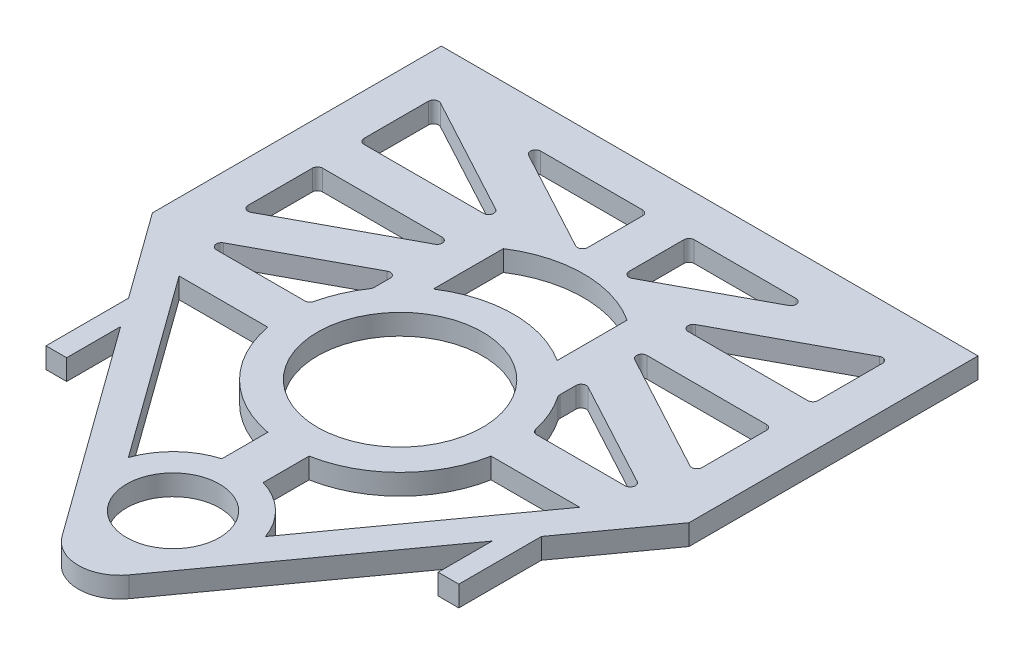
from build123d import *

# Parameters (mm, degrees)
BOSS_EXTRUDE1_DEPTH = 6.35
BOSS_EXTRUDE2_DEPTH = 6.35
CUT_EXTRUDE2_REACH  = 173.121
SKETCH3_R           = 25.4
SKETCH3_R_2         = 14.2875


with BuildPart() as part:
    # Sketch1 → Boss-Extrude1 (new body)
    with BuildSketch(Plane(origin=(0, 0, 0), x_dir=(1, 0, 0), z_dir=(0, 1, 0))):
        with BuildLine():
            Line((-82.55, -44.45), (-10.295626201, -144.494517568))
            ThreePointArc((-10.295626201, -144.494517568), (0, -149.758787534), (10.295626201, -144.494517568))
            Line((10.295626201, -144.494517568), (82.55, -44.45))
            Line((82.55, -44.45), (82.55, 44.45))
            Line((82.55, 44.45), (-82.55, 44.45))
            Line((-82.55, 44.45), (-82.55, -44.45))
        make_face()
    extrude(amount=BOSS_EXTRUDE1_DEPTH)

    # Sketch4 → Boss-Extrude2 (add)
    with BuildSketch(Plane(origin=(0, 6.35, 0), x_dir=(1, 0, 0), z_dir=(0, 1, 0))):
        Polygon((-63.5, -70.826923077), (-63.5, -96.226923077), (-57.15, -96.226923077), (-57.15, -79.619230769), align=None)
        Polygon((57.15, -96.226923077), (63.5, -96.226923077), (63.5, -70.826923077), (57.15, -79.619230769), align=None)
    extrude(amount=-BOSS_EXTRUDE2_DEPTH)

    # Sketch3 → Cut-Extrude2 (cut, up to next)
    with BuildSketch(Plane(origin=(0, 6.35, 0), x_dir=(1, 0, 0), z_dir=(0, 1, 0)), mode=Mode.PRIVATE) as cut_extrude2_sk1:
        with Locations(Location((0, -50.8, 0), (0, 0, 270))):
            Circle(SKETCH3_R)
    cut_extrude2_tool1 = extrude(cut_extrude2_sk1.sketch, amount=-CUT_EXTRUDE2_REACH, mode=Mode.PRIVATE) & part.part
    # Sketch3 → Cut-Extrude2 (cut, up to next)
    with BuildSketch(Plane(origin=(0, 6.35, 0), x_dir=(1, 0, 0), z_dir=(0, 1, 0)), mode=Mode.PRIVATE) as cut_extrude2_sk2:
        with Locations(Location((0, -120.65, 0), (0, 0, 270))):
            Circle(SKETCH3_R_2)
    cut_extrude2_tool2 = extrude(cut_extrude2_sk2.sketch, amount=-CUT_EXTRUDE2_REACH, mode=Mode.PRIVATE) & part.part
    # Sketch3 → Cut-Extrude2 (cut, up to next)
    with BuildSketch(Plane(origin=(0, 6.35, 0), x_dir=(1, 0, 0), z_dir=(0, 1, 0)), mode=Mode.PRIVATE) as cut_extrude2_sk3:
        with BuildLine():
            Line((-40.026450178, 28.764752129), (-8.690133469, 11.891350824))
            ThreePointArc((-8.690133469, 11.891350824), (-7.123451286, 11.92620437), (-6.35, 13.289098695))
            Line((-6.35, 13.289098695), (-6.35, 30.1625))
            ThreePointArc((-6.35, 30.1625), (-6.814967985, 31.285032015), (-7.9375, 31.75))
            Line((-7.9375, 31.75), (-39.273816708, 31.75))
            ThreePointArc((-39.273816708, 31.75), (-40.813147894, 30.550592453), (-40.026450178, 28.764752129))
        make_face()
    cut_extrude2_tool3 = extrude(cut_extrude2_sk3.sketch, amount=-CUT_EXTRUDE2_REACH, mode=Mode.PRIVATE) & part.part
    # Sketch3 → Cut-Extrude2 (cut, up to next)
    with BuildSketch(Plane(origin=(0, 6.35, 0), x_dir=(1, 0, 0), z_dir=(0, 1, 0)), mode=Mode.PRIVATE) as cut_extrude2_sk4:
        with BuildLine():
            Line((-69.85, 27.741670535), (-69.85, 7.9375))
            ThreePointArc((-69.85, 7.9375), (-69.385032015, 6.814967985), (-68.2625, 6.35))
            Line((-68.2625, 6.35), (-31.483326149, 6.35))
            ThreePointArc((-31.483326149, 6.35), (-29.943994963, 7.549407547), (-30.73069268, 9.335247871))
            Line((-30.73069268, 9.335247871), (-67.509866531, 29.139418406))
            ThreePointArc((-67.509866531, 29.139418406), (-69.076548714, 29.10456486), (-69.85, 27.741670535))
        make_face()
    cut_extrude2_tool4 = extrude(cut_extrude2_sk4.sketch, amount=-CUT_EXTRUDE2_REACH, mode=Mode.PRIVATE) & part.part
    # Sketch3 → Cut-Extrude2 (cut, up to next)
    with BuildSketch(Plane(origin=(0, 6.35, 0), x_dir=(1, 0, 0), z_dir=(0, 1, 0)), mode=Mode.PRIVATE) as cut_extrude2_sk5:
        with BuildLine():
            Line((7.9375, 31.75), (39.273816708, 31.75))
            ThreePointArc((39.273816708, 31.75), (40.813147894, 30.550592453), (40.026450178, 28.764752129))
            Line((40.026450178, 28.764752129), (8.690133469, 11.891350824))
            ThreePointArc((8.690133469, 11.891350824), (7.123451286, 11.92620437), (6.35, 13.289098695))
            Line((6.35, 13.289098695), (6.35, 30.1625))
            ThreePointArc((6.35, 30.1625), (6.814967985, 31.285032015), (7.9375, 31.75))
        make_face()
    cut_extrude2_tool5 = extrude(cut_extrude2_sk5.sketch, amount=-CUT_EXTRUDE2_REACH, mode=Mode.PRIVATE) & part.part
    # Sketch3 → Cut-Extrude2 (cut, up to next)
    with BuildSketch(Plane(origin=(0, 6.35, 0), x_dir=(1, 0, 0), z_dir=(0, 1, 0)), mode=Mode.PRIVATE) as cut_extrude2_sk6:
        with BuildLine():
            Line((30.73069268, 9.335247871), (67.509866531, 29.139418406))
            ThreePointArc((67.509866531, 29.139418406), (69.076548714, 29.10456486), (69.85, 27.741670535))
            Line((69.85, 27.741670535), (69.85, 7.9375))
            ThreePointArc((69.85, 7.9375), (69.385032015, 6.814967985), (68.2625, 6.35))
            Line((68.2625, 6.35), (31.483326149, 6.35))
            ThreePointArc((31.483326149, 6.35), (29.943994963, 7.549407547), (30.73069268, 9.335247871))
        make_face()
    cut_extrude2_tool6 = extrude(cut_extrude2_sk6.sketch, amount=-CUT_EXTRUDE2_REACH, mode=Mode.PRIVATE) & part.part
    # Sketch3 → Cut-Extrude2 (cut, up to next)
    with BuildSketch(Plane(origin=(0, 6.35, 0), x_dir=(1, 0, 0), z_dir=(0, 1, 0)), mode=Mode.PRIVATE) as cut_extrude2_sk7:
        with BuildLine():
            Line((69.85, -27.741670535), (69.85, -7.9375))
            ThreePointArc((69.85, -7.9375), (69.385032015, -6.814967985), (68.2625, -6.35))
            Line((68.2625, -6.35), (31.483326149, -6.35))
            ThreePointArc((31.483326149, -6.35), (29.943994963, -7.549407547), (30.73069268, -9.335247871))
            Line((30.73069268, -9.335247871), (67.509866531, -29.139418406))
            ThreePointArc((67.509866531, -29.139418406), (69.076548714, -29.10456486), (69.85, -27.741670535))
        make_face()
    cut_extrude2_tool7 = extrude(cut_extrude2_sk7.sketch, amount=-CUT_EXTRUDE2_REACH, mode=Mode.PRIVATE) & part.part
    # Sketch3 → Cut-Extrude2 (cut, up to next)
    with BuildSketch(Plane(origin=(0, 6.35, 0), x_dir=(1, 0, 0), z_dir=(0, 1, 0)), mode=Mode.PRIVATE) as cut_extrude2_sk8:
        with BuildLine():
            Line((-30.73069268, -9.335247871), (-67.509866531, -29.139418406))
            ThreePointArc((-67.509866531, -29.139418406), (-69.076548714, -29.10456486), (-69.85, -27.741670535))
            Line((-69.85, -27.741670535), (-69.85, -7.9375))
            ThreePointArc((-69.85, -7.9375), (-69.385032015, -6.814967985), (-68.2625, -6.35))
            Line((-68.2625, -6.35), (-31.483326149, -6.35))
            ThreePointArc((-31.483326149, -6.35), (-29.943994963, -7.549407547), (-30.73069268, -9.335247871))
        make_face()
    cut_extrude2_tool8 = extrude(cut_extrude2_sk8.sketch, amount=-CUT_EXTRUDE2_REACH, mode=Mode.PRIVATE) & part.part
    # Sketch3 → Cut-Extrude2 (cut, up to next)
    with BuildSketch(Plane(origin=(0, 6.35, 0), x_dir=(1, 0, 0), z_dir=(0, 1, 0)), mode=Mode.PRIVATE) as cut_extrude2_sk9:
        with BuildLine():
            Line((-6.35, -85.142875899), (-6.35, -99.265701316))
            ThreePointArc((-6.35, -99.265701316), (-15.402705776, -104.514096399), (-21.066111407, -113.313128703))
            Line((-21.066111407, -113.313128703), (-61.628371026, -57.15))
            Line((-61.628371026, -57.15), (-34.342875899, -57.15))
            ThreePointArc((-34.342875899, -57.15), (-24.695704333, -75.495704333), (-6.35, -85.142875899))
        make_face()
    cut_extrude2_tool9 = extrude(cut_extrude2_sk9.sketch, amount=-CUT_EXTRUDE2_REACH, mode=Mode.PRIVATE) & part.part
    # Sketch3 → Cut-Extrude2 (cut, up to next)
    with BuildSketch(Plane(origin=(0, 6.35, 0), x_dir=(1, 0, 0), z_dir=(0, 1, 0)), mode=Mode.PRIVATE) as cut_extrude2_sk10:
        with BuildLine():
            Line((6.35, -85.142875899), (6.35, -99.265701316))
            ThreePointArc((6.35, -99.265701316), (15.402705776, -104.514096399), (21.066111407, -113.313128703))
            Line((21.066111407, -113.313128703), (61.628371026, -57.15))
            Line((61.628371026, -57.15), (34.342875899, -57.15))
            ThreePointArc((34.342875899, -57.15), (24.695704333, -75.495704333), (6.35, -85.142875899))
        make_face()
    cut_extrude2_tool10 = extrude(cut_extrude2_sk10.sketch, amount=-CUT_EXTRUDE2_REACH, mode=Mode.PRIVATE) & part.part
    # Sketch3 → Cut-Extrude2 (cut, up to next)
    with BuildSketch(Plane(origin=(0, 6.35, 0), x_dir=(1, 0, 0), z_dir=(0, 1, 0)), mode=Mode.PRIVATE) as cut_extrude2_sk11:
        with BuildLine():
            Line((-19.05, -21.527946348), (-19.05, 0))
            ThreePointArc((-19.05, 0), (0, 5.652946348), (19.05, 0))
            Line((19.05, 0), (19.05, -21.527946348))
            ThreePointArc((19.05, -21.527946348), (0, -15.875), (-19.05, -21.527946348))
        make_face()
    cut_extrude2_tool11 = extrude(cut_extrude2_sk11.sketch, amount=-CUT_EXTRUDE2_REACH, mode=Mode.PRIVATE) & part.part
    # Sketch3 → Cut-Extrude2 (cut, up to next)
    with BuildSketch(Plane(origin=(0, 6.35, 0), x_dir=(1, 0, 0), z_dir=(0, 1, 0)), mode=Mode.PRIVATE) as cut_extrude2_sk12:
        with BuildLine():
            Line((-62.859530994, -44.45), (-35.639286609, -44.45))
            ThreePointArc((-35.639286609, -44.45), (-34.646236712, -44.101050827), (-34.089752409, -43.207608696))
            ThreePointArc((-34.089752409, -43.207608696), (-32.045675665, -36.913665127), (-28.851086957, -31.11827227))
            ThreePointArc((-28.851086957, -31.11827227), (-28.645591226, -30.691776493), (-28.575, -30.223648283))
            Line((-28.575, -30.223648283), (-28.575, -25.256406388))
            ThreePointArc((-28.575, -25.256406388), (-29.348451286, -23.893512063), (-30.915133469, -23.858658517))
            Line((-30.915133469, -23.858658517), (-63.612164463, -41.464752129))
            ThreePointArc((-63.612164463, -41.464752129), (-64.398862179, -43.250592453), (-62.859530994, -44.45))
        make_face()
    cut_extrude2_tool12 = extrude(cut_extrude2_sk12.sketch, amount=-CUT_EXTRUDE2_REACH, mode=Mode.PRIVATE) & part.part
    # Sketch3 → Cut-Extrude2 (cut, up to next)
    with BuildSketch(Plane(origin=(0, 6.35, 0), x_dir=(1, 0, 0), z_dir=(0, 1, 0)), mode=Mode.PRIVATE) as cut_extrude2_sk13:
        with BuildLine():
            Line((28.575, -25.256406388), (28.575, -30.223648283))
            ThreePointArc((28.575, -30.223648283), (28.645591226, -30.691776493), (28.851086957, -31.11827227))
            ThreePointArc((28.851086957, -31.11827227), (32.045675665, -36.913665127), (34.089752409, -43.207608696))
            ThreePointArc((34.089752409, -43.207608696), (34.646236712, -44.101050827), (35.639286609, -44.45))
            Line((35.639286609, -44.45), (62.859530994, -44.45))
            ThreePointArc((62.859530994, -44.45), (64.398862179, -43.250592453), (63.612164463, -41.464752129))
            Line((63.612164463, -41.464752129), (30.915133469, -23.858658517))
            ThreePointArc((30.915133469, -23.858658517), (29.348451286, -23.893512063), (28.575, -25.256406388))
        make_face()
    cut_extrude2_tool13 = extrude(cut_extrude2_sk13.sketch, amount=-CUT_EXTRUDE2_REACH, mode=Mode.PRIVATE) & part.part
    add(cut_extrude2_tool1.solids().sort_by_distance((0, 6.35, 50.8))[0], mode=Mode.SUBTRACT)
    add(cut_extrude2_tool2.solids().sort_by_distance((0, 6.35, 120.65))[0], mode=Mode.SUBTRACT)
    add(cut_extrude2_tool3.solids().sort_by_distance((-19.115543, 6.35, -24.652033))[0], mode=Mode.SUBTRACT)
    add(cut_extrude2_tool4.solids().sort_by_distance((-55.236845, 6.35, -14.418636))[0], mode=Mode.SUBTRACT)
    add(cut_extrude2_tool5.solids().sort_by_distance((19.115543, 6.35, -24.652033))[0], mode=Mode.SUBTRACT)
    add(cut_extrude2_tool6.solids().sort_by_distance((55.236845, 6.35, -14.418636))[0], mode=Mode.SUBTRACT)
    add(cut_extrude2_tool7.solids().sort_by_distance((55.236845, 6.35, 14.418636))[0], mode=Mode.SUBTRACT)
    add(cut_extrude2_tool8.solids().sort_by_distance((-55.236845, 6.35, 14.418636))[0], mode=Mode.SUBTRACT)
    add(cut_extrude2_tool9.solids().sort_by_distance((-30.896348, 6.35, 81.78683))[0], mode=Mode.SUBTRACT)
    add(cut_extrude2_tool10.solids().sort_by_distance((30.896348, 6.35, 81.78683))[0], mode=Mode.SUBTRACT)
    add(cut_extrude2_tool11.solids().sort_by_distance((0, 6.35, 6.929783))[0], mode=Mode.SUBTRACT)
    add(cut_extrude2_tool12.solids().sort_by_distance((-43.155831, 6.35, 36.82378))[0], mode=Mode.SUBTRACT)
    add(cut_extrude2_tool13.solids().sort_by_distance((43.155831, 6.35, 36.82378))[0], mode=Mode.SUBTRACT)


solid = part.part
